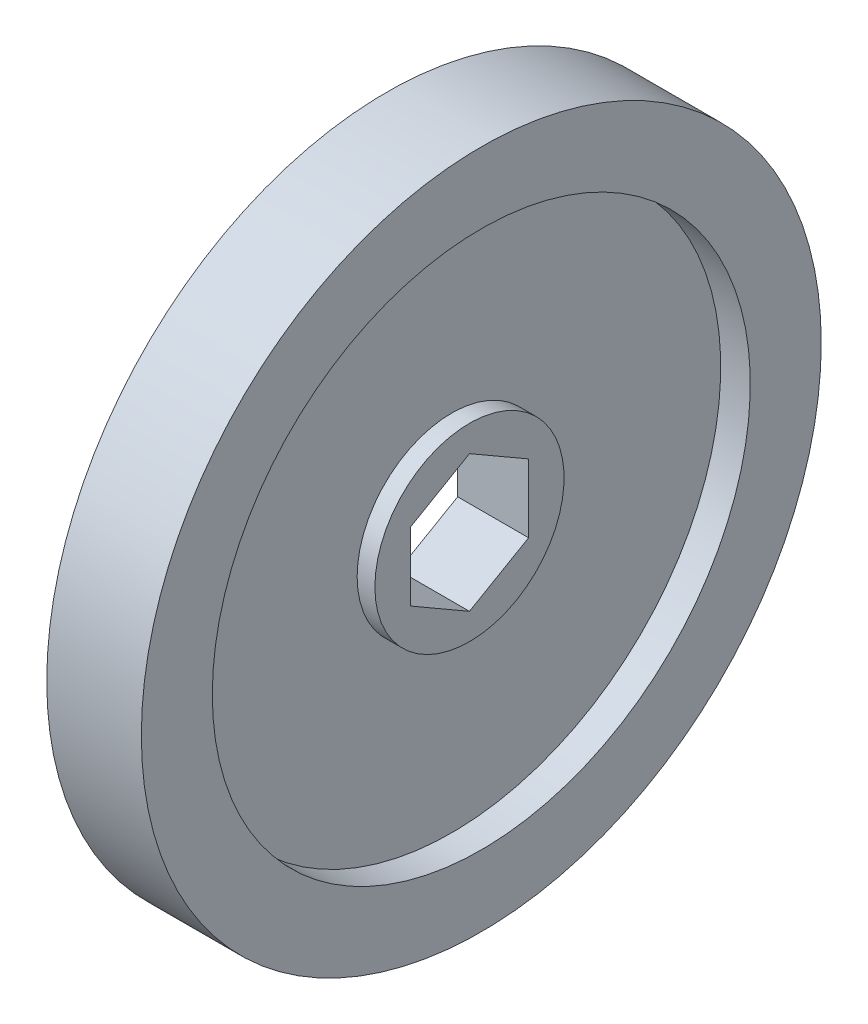
from build123d import *

# Parameters (mm, degrees)
ENL_V_MAT_EXTRU_1_DEPTH = 53.396158375


with BuildPart() as part:
    # Esquisse1 → Révolution1 (revolve)
    with BuildSketch(Plane.XY, mode=Mode.PRIVATE) as r_volution1_sk:
        Polygon((-5.08, 36.5125), (5.08, 36.5125), (5.08, 28.8925), (1.905, 28.8925), (1.905, 10.16), (3.81, 10.16), (3.81, 0), (-3.81, 0), (-3.81, 10.16), (-1.905, 10.16), (-1.905, 28.8925), (-5.08, 28.8925), align=None)
    revolve(r_volution1_sk.sketch.rotate(Axis((-12.56603466, 0, 0), (1, 0, 0)), 90), axis=Axis((-12.56603466, 0, 0), (1, 0, 0)))

    # Esquisse2 → Enlèv. mat.-Extru.1 (cut, through all)
    with BuildSketch(Plane(origin=(3.81, 0, 0), x_dir=(0, 0, -1), z_dir=(1, 0, 0))):
        Polygon((0, 7.332348419), (-6.35, 3.666174209), (-6.35, -3.666174209), (0, -7.332348419), (6.35, -3.666174209), (6.35, 3.666174209), align=None)
    extrude(amount=-ENL_V_MAT_EXTRU_1_DEPTH, mode=Mode.SUBTRACT)


solid = part.part
